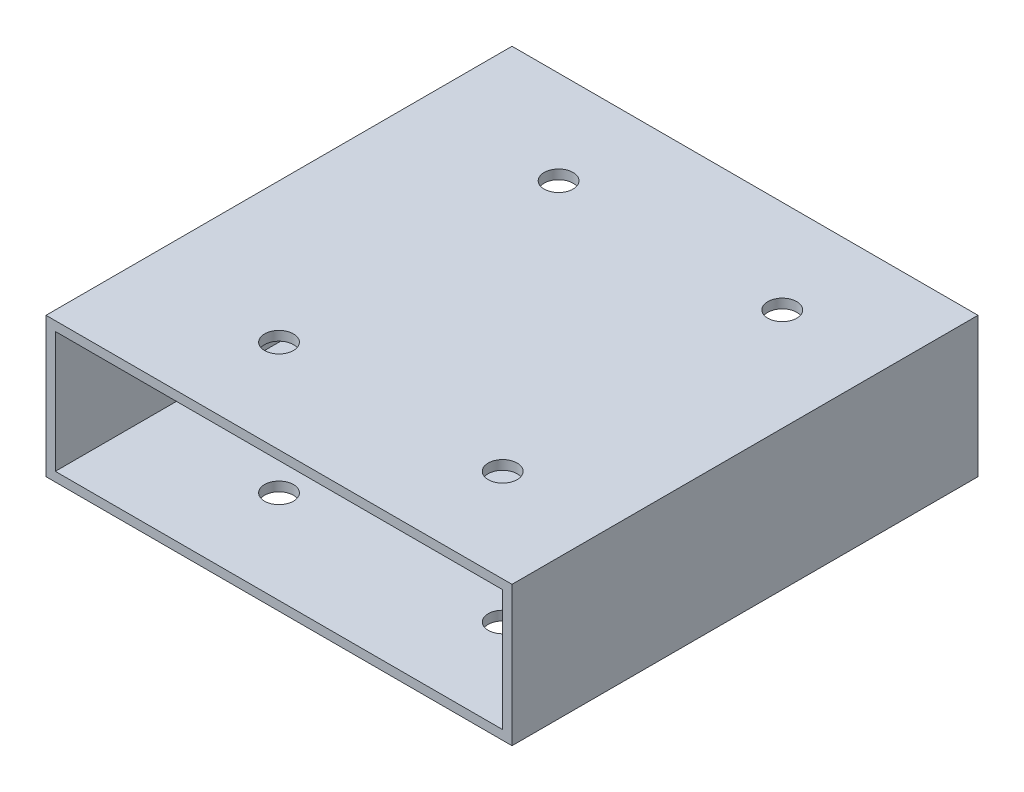
from build123d import *

# Parameters (mm, degrees)
SKETCH_1_W          = 50
SKETCH_1_H          = 15
SKETCH_1_W_2        = 48
SKETCH_1_H_2        = 13
EXTRUDE_1_DEPTH     = 50
SKETCH_2_R          = 1.55
CUT_EXTRUDE_1_DEPTH = 73.284161474


with BuildPart() as part:
    # 草图1 → 凸台-拉伸1 (new body)
    with BuildSketch(Plane.XY):
        with Locations((25, 7.5)):
            Rectangle(SKETCH_1_W, SKETCH_1_H)
        with Locations((25, 7.5)):
            Rectangle(SKETCH_1_W_2, SKETCH_1_H_2, mode=Mode.SUBTRACT)
    extrude(amount=EXTRUDE_1_DEPTH)

    # 草图2 → 切除-拉伸1 (cut, through all)
    with BuildSketch(Plane(origin=(0, 15, 0), x_dir=(1, 0, 0), z_dir=(0, 1, 0))):
        with Locations(Location((39, -10, 0), (0, 0, 270))):
            Circle(SKETCH_2_R)
        with Locations(Location((15, -10, 0), (0, 0, 270))):
            Circle(SKETCH_2_R)
        with Locations(Location((15, -40, 0), (0, 0, 270))):
            Circle(SKETCH_2_R)
        with Locations(Location((39, -40, 0), (0, 0, 270))):
            Circle(SKETCH_2_R)
    extrude(amount=-CUT_EXTRUDE_1_DEPTH, mode=Mode.SUBTRACT)


solid = part.part
